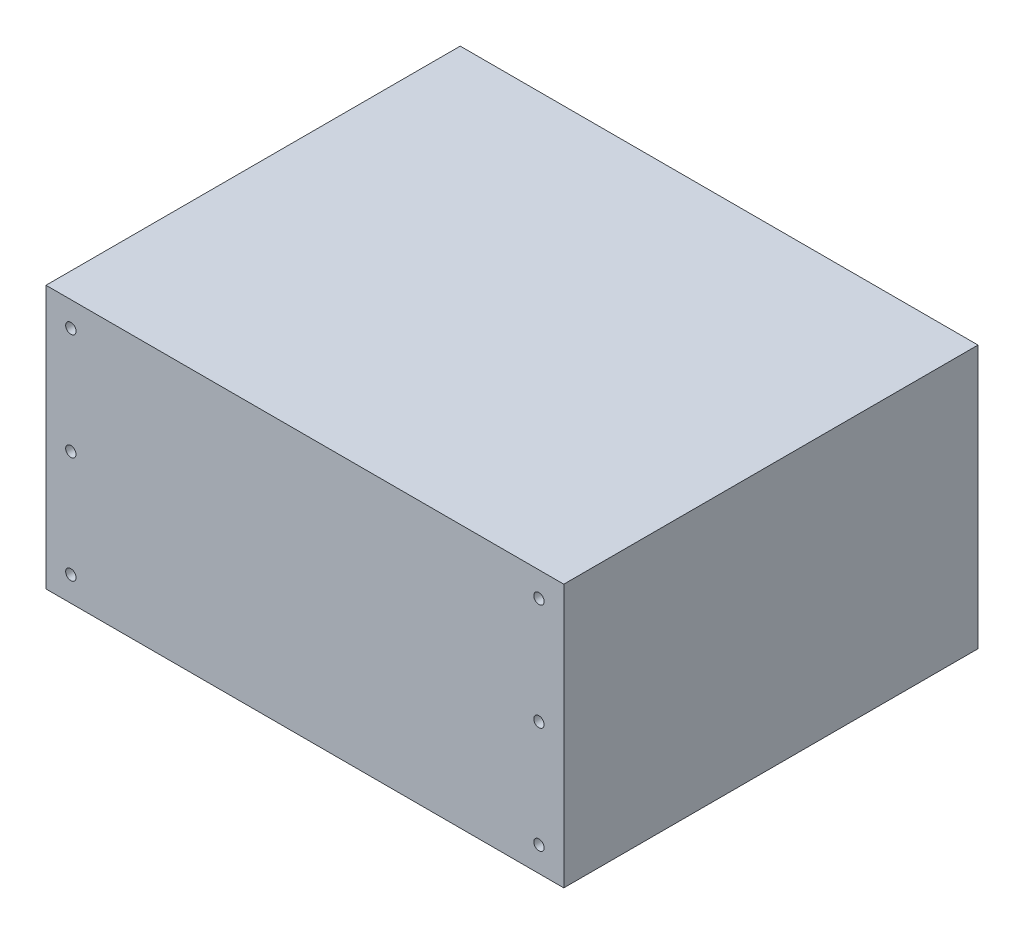
from build123d import *

# Parameters (mm, degrees)
SKETCH1_W                       = 125
SKETCH1_H                       = 63.5
BOSS_EXTRUDE1_DEPTH             = 100
TAP_DRILL_FOR_M3X0_5_TAP1_D     = 2.5
TAP_DRILL_FOR_M3X0_5_TAP1_DEPTH = 5
TAP_DRILL_FOR_M3X0_5_TAP1_TIP   = 0.751075774


with BuildPart() as part:
    # Sketch1 → Boss-Extrude1 (new body)
    with BuildSketch(Plane.XY):
        with Locations((62.5, 31.75)):
            Rectangle(SKETCH1_W, SKETCH1_H)
    extrude(amount=BOSS_EXTRUDE1_DEPTH)

    # Tap Drill for M3x0.5 Tap1
    with Locations(Plane.XY.offset(100)):
        with Locations((6, 57.5), (119, 57.5), (119, 6), (6, 6), (119, 31.75), (6, 31.75)):
            Hole(TAP_DRILL_FOR_M3X0_5_TAP1_D / 2, depth=TAP_DRILL_FOR_M3X0_5_TAP1_DEPTH)
            with Locations((0, 0, -(TAP_DRILL_FOR_M3X0_5_TAP1_DEPTH + TAP_DRILL_FOR_M3X0_5_TAP1_TIP / 2))):  # 118° drill point
                Cone(0, TAP_DRILL_FOR_M3X0_5_TAP1_D / 2, TAP_DRILL_FOR_M3X0_5_TAP1_TIP, mode=Mode.SUBTRACT)


solid = part.part
